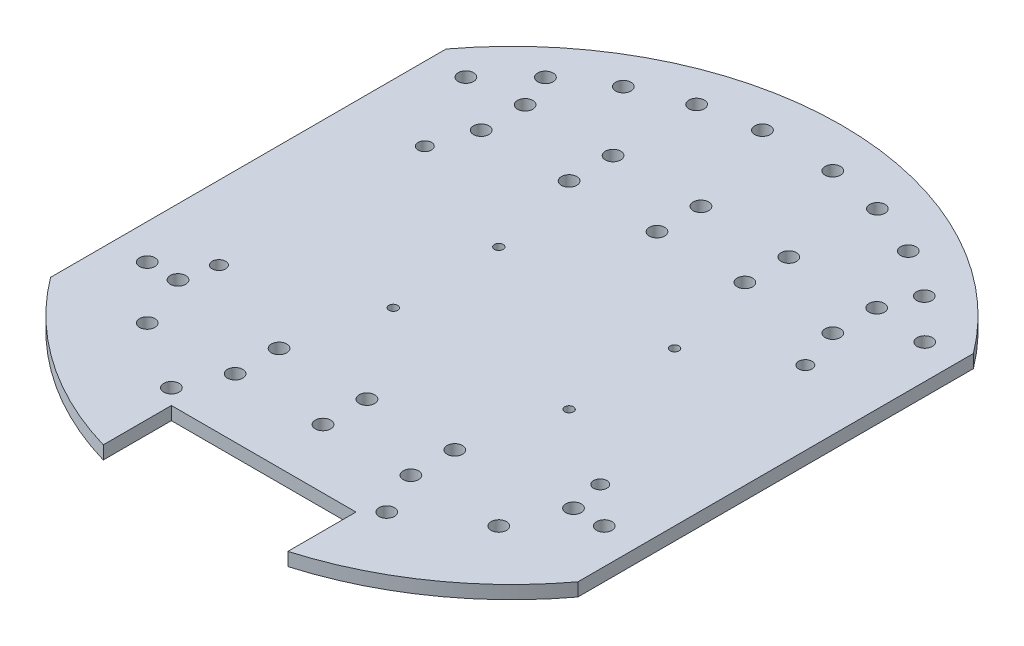
from build123d import *

# Parameters (mm, degrees)
SKETCH1_R                      = 75
BOSS_EXTRUDE1_DEPTH            = 3
SKETCH2_W                      = 19.192652792
SKETCH2_H                      = 120
CUT_EXTRUDE1_DEPTH             = 4
F_3_5_3_5_DIAMETER_HOLE1_D     = 3.5
F_3_5_3_5_DIAMETER_HOLE1_DEPTH = 4
F_3_5_3_5_DIAMETER_HOLE1_TIP   = 1.051506083
F_2_0_2_DIAMETER_HOLE1_D       = 2
F_2_0_2_DIAMETER_HOLE1_DEPTH   = 5
F_2_0_2_DIAMETER_HOLE1_TIP     = 0.600860619
CUT_EXTRUDE2_START             = -10
CUT_EXTRUDE2_DEPTH             = 10
SKETCH18_R                     = 1.525
CUT_EXTRUDE3_DEPTH             = 10
SKETCH19_R                     = 1.75
CUT_EXTRUDE4_DEPTH             = 10
CUT_EXTRUDE5_REACH             = 98.094
SKETCH21_R                     = 1.75


with BuildPart() as part:
    # Sketch1 → Boss-Extrude1 (new body)
    with BuildSketch(Plane(origin=(0, 0, 0), x_dir=(1, 0, 0), z_dir=(0, 1, 0))):
        with Locations(Location((0, 0, 0), (0, 0, 270))):
            Circle(SKETCH1_R)
    extrude(amount=BOSS_EXTRUDE1_DEPTH)

    # Sketch2 → Cut-Extrude1 (cut)
    with BuildSketch(Plane(origin=(0, 3, 0), x_dir=(1, 0, 0), z_dir=(0, 1, 0))):
        with Locations((-69.596326396, 0)):
            Rectangle(SKETCH2_W, SKETCH2_H)
    cut_extrude1 = extrude(amount=-CUT_EXTRUDE1_DEPTH, mode=Mode.SUBTRACT)

    # Mirror1: Cut-Extrude1 across plane
    add(cut_extrude1.mirror(Plane(origin=(0, 0, 0), x_dir=(0, 0, 1), z_dir=(1, 0, 0))), mode=Mode.SUBTRACT)

    # Ø3.5 (3.5) Diameter Hole1
    with Locations(Plane(origin=(0, 0, 0), x_dir=(-1, 0, 0), z_dir=(0, -1, 0))):
        with Locations((40, -43), (-40, -43), (-40, 43), (40, 43)):
            Hole(F_3_5_3_5_DIAMETER_HOLE1_D / 2, depth=F_3_5_3_5_DIAMETER_HOLE1_DEPTH)
            with Locations((0, 0, -(F_3_5_3_5_DIAMETER_HOLE1_DEPTH + F_3_5_3_5_DIAMETER_HOLE1_TIP / 2))):  # 118° drill point
                Cone(0, F_3_5_3_5_DIAMETER_HOLE1_D / 2, F_3_5_3_5_DIAMETER_HOLE1_TIP, mode=Mode.SUBTRACT)

    # Ø2.0 (2) Diameter Hole1
    with Locations(Plane(origin=(0, 3, 0), x_dir=(1, 0, 0), z_dir=(0, 1, 0))):
        with Locations((25, -12), (25, 12), (-15, 12), (-15, -12)):
            Hole(F_2_0_2_DIAMETER_HOLE1_D / 2, depth=F_2_0_2_DIAMETER_HOLE1_DEPTH)
            with Locations((0, 0, -(F_2_0_2_DIAMETER_HOLE1_DEPTH + F_2_0_2_DIAMETER_HOLE1_TIP / 2))):  # 118° drill point
                Cone(0, F_2_0_2_DIAMETER_HOLE1_D / 2, F_2_0_2_DIAMETER_HOLE1_TIP, mode=Mode.SUBTRACT)

    # Sketch15 → Cut-Extrude2 (cut)
    with BuildSketch(Plane(origin=(0, 3, 0), x_dir=(1, 0, 0), z_dir=(0, 1, 0)).offset(CUT_EXTRUDE2_START)):
        with BuildLine():
            ThreePointArc((-21, -72), (0, -75), (21, -72))
            Line((21, -72), (21, -56.5))
            Line((21, -56.5), (-21, -56.5))
            Line((-21, -56.5), (-21, -72))
        make_face()
    extrude(amount=CUT_EXTRUDE2_DEPTH, mode=Mode.SUBTRACT)

    # Sketch18 → Cut-Extrude3 (cut)
    with BuildSketch(Plane(origin=(0, 3, 0), x_dir=(1, 0, 0), z_dir=(0, 1, 0))):
        with Locations(Location((-43.257585448, 23.425, 0), (0, 0, 270))):
            Circle(SKETCH18_R)
        with Locations(Location((-43.257585448, -23.425, 0), (0, 0, 270))):
            Circle(SKETCH18_R)
        with Locations(Location((43.170117025, 23.585807594, 0), (0, 0, 270))):
            Circle(SKETCH18_R)
        with Locations(Location((43.34445487, -23.263868032, 0), (0, 0, 270))):
            Circle(SKETCH18_R)
    extrude(amount=-CUT_EXTRUDE3_DEPTH, mode=Mode.SUBTRACT)

    # Sketch19 → Cut-Extrude4 (cut)
    with BuildSketch(Plane(origin=(0, 3, 0), x_dir=(1, 0, 0), z_dir=(0, 1, 0))):
        with Locations(Location((-32.417700299, 57.756069019, 0), (0, 0, 270))):
            Circle(SKETCH19_R)
        with Locations(Location((-20.565582613, 62.580501294, 0), (0, 0, 270))):
            Circle(SKETCH19_R)
        with Locations(Location((-8, 65, 0), (0, 0, 270))):
            Circle(SKETCH19_R)
        with Locations(Location((8, 65, 0), (0, 0, 270))):
            Circle(SKETCH19_R)
        with Locations(Location((20.565582613, 62.580501294, 0), (0, 0, 270))):
            Circle(SKETCH19_R)
        with Locations(Location((32.417700299, 57.756069019, 0), (0, 0, 270))):
            Circle(SKETCH19_R)
        with Locations(Location((43.10088282, 50.712103402, 0), (0, 0, 270))):
            Circle(SKETCH19_R)
        with Locations(Location((-52.204581464, 41.71930009, 0), (0, 0, 270))):
            Circle(SKETCH19_R)
        with Locations(Location((-43.10088282, 50.712103402, 0), (0, 0, 270))):
            Circle(SKETCH19_R)
        with Locations(Location((52.204581464, 41.71930009, 0), (0, 0, 270))):
            Circle(SKETCH19_R)
    extrude(amount=-CUT_EXTRUDE4_DEPTH, mode=Mode.SUBTRACT)

    # Sketch21 → Cut-Extrude5 (cut, up to next)
    with BuildSketch(Plane(origin=(0, 3, 0), x_dir=(1, 0, 0), z_dir=(0, 1, 0)), mode=Mode.PRIVATE) as cut_extrude5_sk1:
        with Locations(Location((-52, -31, 0), (0, 0, 270))):
            Circle(SKETCH21_R)
    cut_extrude5_tool1 = extrude(cut_extrude5_sk1.sketch, amount=-CUT_EXTRUDE5_REACH, mode=Mode.PRIVATE) & part.part
    # Sketch21 → Cut-Extrude5 (cut, up to next)
    with BuildSketch(Plane(origin=(0, 3, 0), x_dir=(1, 0, 0), z_dir=(0, 1, 0)), mode=Mode.PRIVATE) as cut_extrude5_sk2:
        with Locations(Location((-24.5, -53, 0), (0, 0, 270))):
            Circle(SKETCH21_R)
    cut_extrude5_tool2 = extrude(cut_extrude5_sk2.sketch, amount=-CUT_EXTRUDE5_REACH, mode=Mode.PRIVATE) & part.part
    # Sketch21 → Cut-Extrude5 (cut, up to next)
    with BuildSketch(Plane(origin=(0, 3, 0), x_dir=(1, 0, 0), z_dir=(0, 1, 0)), mode=Mode.PRIVATE) as cut_extrude5_sk3:
        with Locations(Location((-20, -43, 0), (0, 0, 270))):
            Circle(SKETCH21_R)
    cut_extrude5_tool3 = extrude(cut_extrude5_sk3.sketch, amount=-CUT_EXTRUDE5_REACH, mode=Mode.PRIVATE) & part.part
    # Sketch21 → Cut-Extrude5 (cut, up to next)
    with BuildSketch(Plane(origin=(0, 3, 0), x_dir=(1, 0, 0), z_dir=(0, 1, 0)), mode=Mode.PRIVATE) as cut_extrude5_sk4:
        with Locations(Location((0, -43, 0), (0, 0, 270))):
            Circle(SKETCH21_R)
    cut_extrude5_tool4 = extrude(cut_extrude5_sk4.sketch, amount=-CUT_EXTRUDE5_REACH, mode=Mode.PRIVATE) & part.part
    # Sketch21 → Cut-Extrude5 (cut, up to next)
    with BuildSketch(Plane(origin=(0, 3, 0), x_dir=(1, 0, 0), z_dir=(0, 1, 0)), mode=Mode.PRIVATE) as cut_extrude5_sk5:
        with Locations(Location((20, -43, 0), (0, 0, 270))):
            Circle(SKETCH21_R)
    cut_extrude5_tool5 = extrude(cut_extrude5_sk5.sketch, amount=-CUT_EXTRUDE5_REACH, mode=Mode.PRIVATE) & part.part
    # Sketch21 → Cut-Extrude5 (cut, up to next)
    with BuildSketch(Plane(origin=(0, 3, 0), x_dir=(1, 0, 0), z_dir=(0, 1, 0)), mode=Mode.PRIVATE) as cut_extrude5_sk6:
        with Locations(Location((24.5, -53, 0), (0, 0, 270))):
            Circle(SKETCH21_R)
    cut_extrude5_tool6 = extrude(cut_extrude5_sk6.sketch, amount=-CUT_EXTRUDE5_REACH, mode=Mode.PRIVATE) & part.part
    # Sketch21 → Cut-Extrude5 (cut, up to next)
    with BuildSketch(Plane(origin=(0, 3, 0), x_dir=(1, 0, 0), z_dir=(0, 1, 0)), mode=Mode.PRIVATE) as cut_extrude5_sk7:
        with Locations(Location((45, -31, 0), (0, 0, 270))):
            Circle(SKETCH21_R)
    cut_extrude5_tool7 = extrude(cut_extrude5_sk7.sketch, amount=-CUT_EXTRUDE5_REACH, mode=Mode.PRIVATE) & part.part
    # Sketch21 → Cut-Extrude5 (cut, up to next)
    with BuildSketch(Plane(origin=(0, 3, 0), x_dir=(1, 0, 0), z_dir=(0, 1, 0)), mode=Mode.PRIVATE) as cut_extrude5_sk8:
        with Locations(Location((52, -31, 0), (0, 0, 270))):
            Circle(SKETCH21_R)
    cut_extrude5_tool8 = extrude(cut_extrude5_sk8.sketch, amount=-CUT_EXTRUDE5_REACH, mode=Mode.PRIVATE) & part.part
    # Sketch21 → Cut-Extrude5 (cut, up to next)
    with BuildSketch(Plane(origin=(0, 3, 0), x_dir=(1, 0, 0), z_dir=(0, 1, 0)), mode=Mode.PRIVATE) as cut_extrude5_sk9:
        with Locations(Location((20, 43, 0), (0, 0, 270))):
            Circle(SKETCH21_R)
    cut_extrude5_tool9 = extrude(cut_extrude5_sk9.sketch, amount=-CUT_EXTRUDE5_REACH, mode=Mode.PRIVATE) & part.part
    # Sketch21 → Cut-Extrude5 (cut, up to next)
    with BuildSketch(Plane(origin=(0, 3, 0), x_dir=(1, 0, 0), z_dir=(0, 1, 0)), mode=Mode.PRIVATE) as cut_extrude5_sk10:
        with Locations(Location((0, 43, 0), (0, 0, 270))):
            Circle(SKETCH21_R)
    cut_extrude5_tool10 = extrude(cut_extrude5_sk10.sketch, amount=-CUT_EXTRUDE5_REACH, mode=Mode.PRIVATE) & part.part
    # Sketch21 → Cut-Extrude5 (cut, up to next)
    with BuildSketch(Plane(origin=(0, 3, 0), x_dir=(1, 0, 0), z_dir=(0, 1, 0)), mode=Mode.PRIVATE) as cut_extrude5_sk11:
        with Locations(Location((-45, -31, 0), (0, 0, 270))):
            Circle(SKETCH21_R)
    cut_extrude5_tool11 = extrude(cut_extrude5_sk11.sketch, amount=-CUT_EXTRUDE5_REACH, mode=Mode.PRIVATE) & part.part
    # Sketch21 → Cut-Extrude5 (cut, up to next)
    with BuildSketch(Plane(origin=(0, 3, 0), x_dir=(1, 0, 0), z_dir=(0, 1, 0)), mode=Mode.PRIVATE) as cut_extrude5_sk12:
        with Locations(Location((-20, 43, 0), (0, 0, 270))):
            Circle(SKETCH21_R)
    cut_extrude5_tool12 = extrude(cut_extrude5_sk12.sketch, amount=-CUT_EXTRUDE5_REACH, mode=Mode.PRIVATE) & part.part
    # Sketch21 → Cut-Extrude5 (cut, up to next)
    with BuildSketch(Plane(origin=(0, 3, 0), x_dir=(1, 0, 0), z_dir=(0, 1, 0)), mode=Mode.PRIVATE) as cut_extrude5_sk13:
        with Locations(Location((-20, -33, 0), (0, 0, 270))):
            Circle(SKETCH21_R)
    cut_extrude5_tool13 = extrude(cut_extrude5_sk13.sketch, amount=-CUT_EXTRUDE5_REACH, mode=Mode.PRIVATE) & part.part
    # Sketch21 → Cut-Extrude5 (cut, up to next)
    with BuildSketch(Plane(origin=(0, 3, 0), x_dir=(1, 0, 0), z_dir=(0, 1, 0)), mode=Mode.PRIVATE) as cut_extrude5_sk14:
        with Locations(Location((0, -33, 0), (0, 0, 270))):
            Circle(SKETCH21_R)
    cut_extrude5_tool14 = extrude(cut_extrude5_sk14.sketch, amount=-CUT_EXTRUDE5_REACH, mode=Mode.PRIVATE) & part.part
    # Sketch21 → Cut-Extrude5 (cut, up to next)
    with BuildSketch(Plane(origin=(0, 3, 0), x_dir=(1, 0, 0), z_dir=(0, 1, 0)), mode=Mode.PRIVATE) as cut_extrude5_sk15:
        with Locations(Location((20, -33, 0), (0, 0, 270))):
            Circle(SKETCH21_R)
    cut_extrude5_tool15 = extrude(cut_extrude5_sk15.sketch, amount=-CUT_EXTRUDE5_REACH, mode=Mode.PRIVATE) & part.part
    # Sketch21 → Cut-Extrude5 (cut, up to next)
    with BuildSketch(Plane(origin=(0, 3, 0), x_dir=(1, 0, 0), z_dir=(0, 1, 0)), mode=Mode.PRIVATE) as cut_extrude5_sk16:
        with Locations(Location((-40, 33, 0), (0, 0, 270))):
            Circle(SKETCH21_R)
    cut_extrude5_tool16 = extrude(cut_extrude5_sk16.sketch, amount=-CUT_EXTRUDE5_REACH, mode=Mode.PRIVATE) & part.part
    # Sketch21 → Cut-Extrude5 (cut, up to next)
    with BuildSketch(Plane(origin=(0, 3, 0), x_dir=(1, 0, 0), z_dir=(0, 1, 0)), mode=Mode.PRIVATE) as cut_extrude5_sk17:
        with Locations(Location((-20, 33, 0), (0, 0, 270))):
            Circle(SKETCH21_R)
    cut_extrude5_tool17 = extrude(cut_extrude5_sk17.sketch, amount=-CUT_EXTRUDE5_REACH, mode=Mode.PRIVATE) & part.part
    # Sketch21 → Cut-Extrude5 (cut, up to next)
    with BuildSketch(Plane(origin=(0, 3, 0), x_dir=(1, 0, 0), z_dir=(0, 1, 0)), mode=Mode.PRIVATE) as cut_extrude5_sk18:
        with Locations(Location((0, 33, 0), (0, 0, 270))):
            Circle(SKETCH21_R)
    cut_extrude5_tool18 = extrude(cut_extrude5_sk18.sketch, amount=-CUT_EXTRUDE5_REACH, mode=Mode.PRIVATE) & part.part
    # Sketch21 → Cut-Extrude5 (cut, up to next)
    with BuildSketch(Plane(origin=(0, 3, 0), x_dir=(1, 0, 0), z_dir=(0, 1, 0)), mode=Mode.PRIVATE) as cut_extrude5_sk19:
        with Locations(Location((20, 33, 0), (0, 0, 270))):
            Circle(SKETCH21_R)
    cut_extrude5_tool19 = extrude(cut_extrude5_sk19.sketch, amount=-CUT_EXTRUDE5_REACH, mode=Mode.PRIVATE) & part.part
    # Sketch21 → Cut-Extrude5 (cut, up to next)
    with BuildSketch(Plane(origin=(0, 3, 0), x_dir=(1, 0, 0), z_dir=(0, 1, 0)), mode=Mode.PRIVATE) as cut_extrude5_sk20:
        with Locations(Location((40, 33, 0), (0, 0, 270))):
            Circle(SKETCH21_R)
    cut_extrude5_tool20 = extrude(cut_extrude5_sk20.sketch, amount=-CUT_EXTRUDE5_REACH, mode=Mode.PRIVATE) & part.part
    add(cut_extrude5_tool1.solids().sort_by_distance((-52, 3, 31))[0], mode=Mode.SUBTRACT)
    add(cut_extrude5_tool2.solids().sort_by_distance((-24.5, 3, 53))[0], mode=Mode.SUBTRACT)
    add(cut_extrude5_tool3.solids().sort_by_distance((-20, 3, 43))[0], mode=Mode.SUBTRACT)
    add(cut_extrude5_tool4.solids().sort_by_distance((0, 3, 43))[0], mode=Mode.SUBTRACT)
    add(cut_extrude5_tool5.solids().sort_by_distance((20, 3, 43))[0], mode=Mode.SUBTRACT)
    add(cut_extrude5_tool6.solids().sort_by_distance((24.5, 3, 53))[0], mode=Mode.SUBTRACT)
    add(cut_extrude5_tool7.solids().sort_by_distance((45, 3, 31))[0], mode=Mode.SUBTRACT)
    add(cut_extrude5_tool8.solids().sort_by_distance((52, 3, 31))[0], mode=Mode.SUBTRACT)
    add(cut_extrude5_tool9.solids().sort_by_distance((20, 3, -43))[0], mode=Mode.SUBTRACT)
    add(cut_extrude5_tool10.solids().sort_by_distance((0, 3, -43))[0], mode=Mode.SUBTRACT)
    add(cut_extrude5_tool11.solids().sort_by_distance((-45, 3, 31))[0], mode=Mode.SUBTRACT)
    add(cut_extrude5_tool12.solids().sort_by_distance((-20, 3, -43))[0], mode=Mode.SUBTRACT)
    add(cut_extrude5_tool13.solids().sort_by_distance((-20, 3, 33))[0], mode=Mode.SUBTRACT)
    add(cut_extrude5_tool14.solids().sort_by_distance((0, 3, 33))[0], mode=Mode.SUBTRACT)
    add(cut_extrude5_tool15.solids().sort_by_distance((20, 3, 33))[0], mode=Mode.SUBTRACT)
    add(cut_extrude5_tool16.solids().sort_by_distance((-40, 3, -33))[0], mode=Mode.SUBTRACT)
    add(cut_extrude5_tool17.solids().sort_by_distance((-20, 3, -33))[0], mode=Mode.SUBTRACT)
    add(cut_extrude5_tool18.solids().sort_by_distance((0, 3, -33))[0], mode=Mode.SUBTRACT)
    add(cut_extrude5_tool19.solids().sort_by_distance((20, 3, -33))[0], mode=Mode.SUBTRACT)
    add(cut_extrude5_tool20.solids().sort_by_distance((40, 3, -33))[0], mode=Mode.SUBTRACT)


solid = part.part
